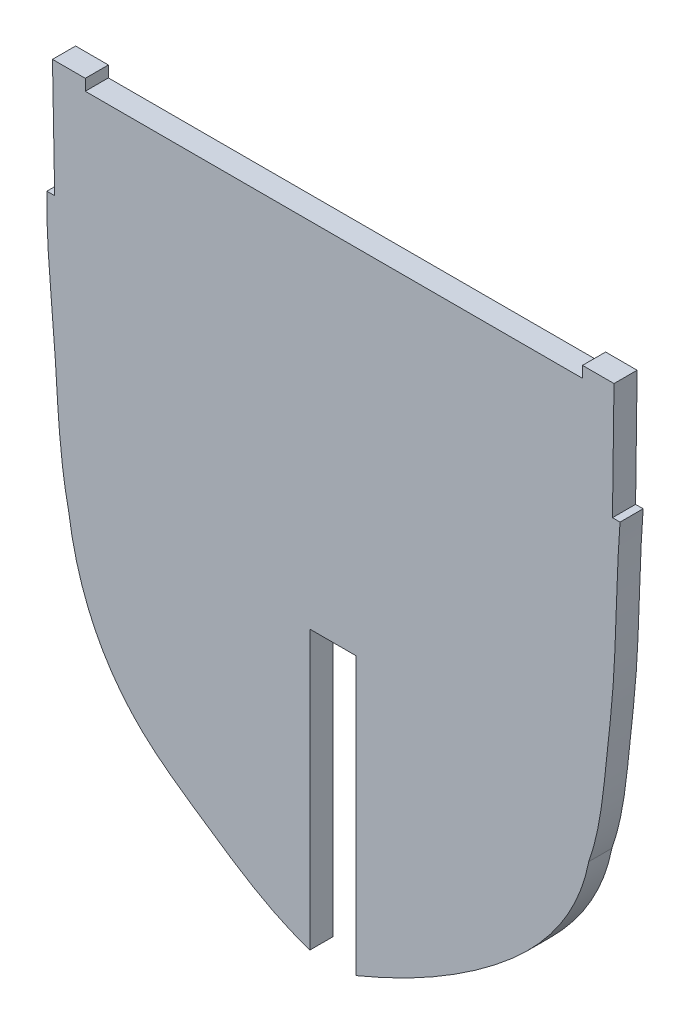
from build123d import *

# Parameters (mm, degrees)
EXTRUDE_1_DEPTH = 4


with BuildPart() as part:
    # 草图1 → 凸台-拉伸1 (new body)
    with BuildSketch(Plane.XY):
        with BuildLine():
            Line((192.01570903, 236.215172683), (197.691755822, 236.215172683))
            Line((197.691755822, 236.215172683), (197.691755822, 234.272114968))
            Line((197.691755822, 234.272114968), (283.716181534, 234.272114968))
            Line((283.716181534, 234.272114968), (283.716181534, 236.215172683))
            Line((283.716181534, 236.215172683), (289.16648845, 236.215172683))
            Line((289.16648845, 236.215172683), (288.899951815, 215.97975226))
            Line((288.899951815, 215.97975226), (290.208767161, 215.97975226))
            add(Edge.make_bspline(
                [(284.799620172, 162.392429744), (286.759474849, 167.893462355), (287.57993928, 177.029821997), (289.649811574, 194.897723767), (289.52739364, 207.149942748), (290.208767161, 215.97975226)],
                knots=[0, 0, 0, 0, 0.321928336, 0.507408205, 1, 1, 1, 1], degree=3))
            add(Edge.make_bspline(
                [(244.559945218, 125.200650029), (246.510897062, 126.005562495), (253.842274844, 129.235901905), (270.285883988, 138.599536344), (282.598559802, 151.178754354), (284.799620172, 162.392429744)],
                knots=[0.030116407, 0.030116407, 0.030116407, 0.030116407, 0.138264507, 0.441021692, 1, 1, 1, 1], degree=3))
            Line((244.559945218, 125.200650029), (244.559945218, 169.113949314))
            Line((244.559945218, 169.113949314), (244.559945218, 173.113949314))
            Line((244.559945218, 173.113949314), (236.559945217, 173.113949314))
            Line((236.559945217, 173.113949314), (236.559945217, 169.113949314))
            Line((236.559945217, 169.113949314), (236.559945217, 125.032675044))
            add(Edge.make_bspline(
                [(194.814526021, 169.905399038), (195.610141371, 164.176898927), (198.346571661, 154.492253984), (207.021687023, 142.787448402), (216.390436057, 136.399663861), (225.951903337, 129.821011624), (232.271114311, 126.432484596), (236.559945217, 125.032675044)],
                knots=[0, 0, 0, 0, 0.262954959, 0.448389479, 0.647828965, 0.773904026, 0.974785001, 0.974785001, 0.974785001, 0.974785001], degree=3))
            add(Edge.make_bspline(
                [(191.044749595, 215.97975226), (190.906681757, 208.303976986), (192.789425639, 192.9807794), (193.135017556, 177.533691326), (194.814526021, 169.905399038)],
                knots=[0, 0, 0, 0, 0.496472492, 1, 1, 1, 1], degree=3))
            Line((191.044749595, 215.97975226), (192.397258047, 215.97975226))
            Line((192.397258047, 215.97975226), (192.01570903, 236.215172683))
        make_face()
    extrude(amount=EXTRUDE_1_DEPTH)


solid = part.part
